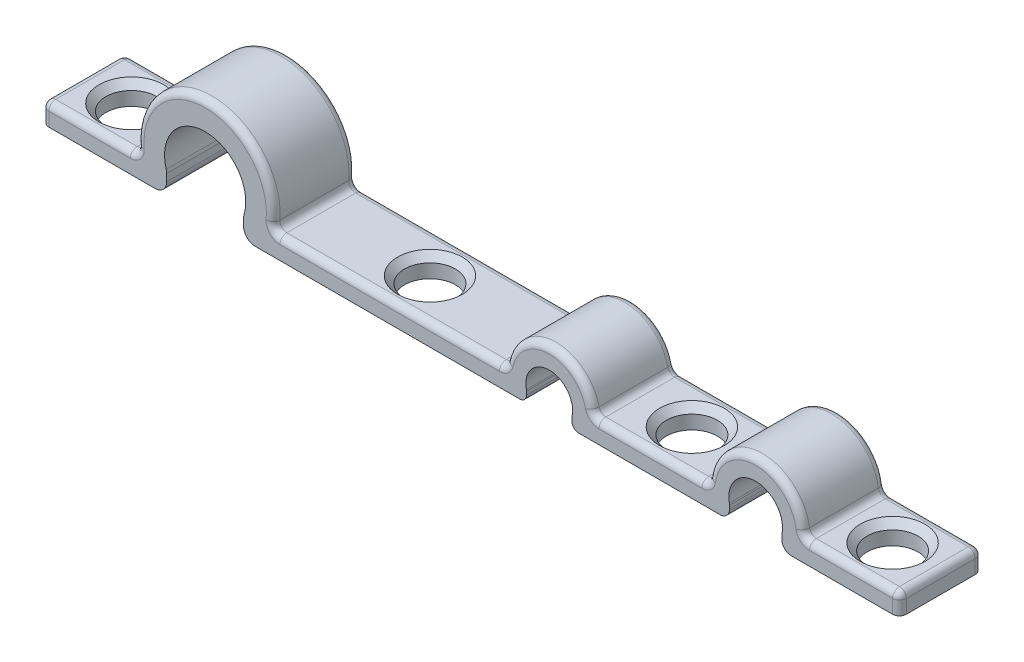
from build123d import *

# Parameters (mm, degrees)
BOSS_EXTRUDE1_DEPTH = 3
CUT_EXTRUDE2_REACH  = 34.161
SKETCH2_R           = 1.85
CHAMFER2_SIZE       = 0.5
FILLET1_R           = 0.5


with BuildPart() as part:
    # Sketch1 → Boss-Extrude1 (new, symmetric)
    with BuildSketch(Plane.XY):
        with BuildLine():
            Line((-31.153810391, 0), (-22.93867528, 0))
            ThreePointArc((-22.93867528, 0), (-22.337634516, 0.248959236), (-22.08867528, 0.85))
            Line((-22.08867528, 0.85), (-22.08867528, 1.36849254))
            ThreePointArc((-22.08867528, 1.36849254), (-22.09750929, 1.490720925), (-22.123827699, 1.610408683))
            ThreePointArc((-22.123827699, 1.610408683), (-19.295827271, 5.4), (-16.467826843, 1.610408683))
            ThreePointArc((-16.467826843, 1.610408683), (-16.494145252, 1.490720925), (-16.502979262, 1.36849254))
            Line((-16.502979262, 1.36849254), (-16.502979262, 0.85))
            ThreePointArc((-16.502979262, 0.85), (-16.254020026, 0.248959236), (-15.652979262, 0))
            Line((-15.652979262, 0), (3.554172729, 0))
            ThreePointArc((3.554172729, 0), (3.90772612, 0.146446609), (4.054172729, 0.5))
            Line((4.054172729, 0.5), (4.054172729, 0.733631047))
            ThreePointArc((4.054172729, 0.733631047), (4.051323703, 0.786931226), (4.042809093, 0.839623991))
            ThreePointArc((4.042809093, 0.839623991), (5.704172729, 2.9), (7.365536366, 0.839623991))
            ThreePointArc((7.365536366, 0.839623991), (7.357021755, 0.786931226), (7.354172729, 0.733631047))
            Line((7.354172729, 0.733631047), (7.354172729, 0.5))
            ThreePointArc((7.354172729, 0.5), (7.500619339, 0.146446609), (7.854172729, 0))
            Line((7.854172729, 0), (18.104172729, 0))
            ThreePointArc((18.104172729, 0), (18.599147476, 0.205025253), (18.804172729, 0.7))
            Line((18.804172729, 0.7), (18.804172729, 0.937652462))
            ThreePointArc((18.804172729, 0.937652462), (18.800863018, 1.005642472), (18.790965182, 1.072989547))
            ThreePointArc((18.790965182, 1.072989547), (20.704172729, 3.4), (22.617380276, 1.072989547))
            ThreePointArc((22.617380276, 1.072989547), (22.60748244, 1.005642472), (22.604172729, 0.937652462))
            Line((22.604172729, 0.937652462), (22.604172729, 0.7))
            ThreePointArc((22.604172729, 0.7), (22.809197982, 0.205025253), (23.304172729, 0))
            Line((23.304172729, 0), (31.153810391, 0))
            Line((31.153810391, 0), (31.153810391, 1.5))
            Line((31.153810391, 1.5), (24.153810391, 1.5))
            ThreePointArc((24.153810391, 1.5), (20.704172729, 4.9), (17.254535067, 1.5))
            Line((17.254535067, 1.5), (8.890079194, 1.5))
            ThreePointArc((8.890079194, 1.5), (5.704172729, 4.4), (2.518266265, 1.5))
            Line((2.518266265, 1.5), (-14.43784415, 1.5))
            ThreePointArc((-14.43784415, 1.5), (-19.295827271, 7.4), (-24.153810391, 1.5))
            Line((-24.153810391, 1.5), (-31.153810391, 1.5))
            Line((-31.153810391, 1.5), (-31.153810391, 0))
        make_face()
    extrude(amount=BOSS_EXTRUDE1_DEPTH, both=True)

    # Sketch2 → Cut-Extrude2 (cut, up to next)
    with BuildSketch(Plane(origin=(0, 0, 0), x_dir=(1, 0, 0), z_dir=(0, 1, 0)), mode=Mode.PRIVATE) as cut_extrude2_sk1:
        with Locations(Location((-27.653810391, 0, 0), (0, 0, 90))):
            Circle(SKETCH2_R)
    cut_extrude2_tool1 = extrude(cut_extrude2_sk1.sketch, amount=CUT_EXTRUDE2_REACH, mode=Mode.PRIVATE) & part.part
    # Sketch2 → Cut-Extrude2 (cut, up to next)
    with BuildSketch(Plane(origin=(0, 0, 0), x_dir=(1, 0, 0), z_dir=(0, 1, 0)), mode=Mode.PRIVATE) as cut_extrude2_sk2:
        with Locations(Location((-5.959788943, 0, 0), (0, 0, 90))):
            Circle(SKETCH2_R)
    cut_extrude2_tool2 = extrude(cut_extrude2_sk2.sketch, amount=CUT_EXTRUDE2_REACH, mode=Mode.PRIVATE) & part.part
    # Sketch2 → Cut-Extrude2 (cut, up to next)
    with BuildSketch(Plane(origin=(0, 0, 0), x_dir=(1, 0, 0), z_dir=(0, 1, 0)), mode=Mode.PRIVATE) as cut_extrude2_sk3:
        with Locations(Location((27.653810391, 0, 0), (0, 0, 90))):
            Circle(SKETCH2_R)
    cut_extrude2_tool3 = extrude(cut_extrude2_sk3.sketch, amount=CUT_EXTRUDE2_REACH, mode=Mode.PRIVATE) & part.part
    # Sketch2 → Cut-Extrude2 (cut, up to next)
    with BuildSketch(Plane(origin=(0, 0, 0), x_dir=(1, 0, 0), z_dir=(0, 1, 0)), mode=Mode.PRIVATE) as cut_extrude2_sk4:
        with Locations(Location((13.07230713, 0, 0), (0, 0, 90))):
            Circle(SKETCH2_R)
    cut_extrude2_tool4 = extrude(cut_extrude2_sk4.sketch, amount=CUT_EXTRUDE2_REACH, mode=Mode.PRIVATE) & part.part
    add(cut_extrude2_tool1.solids().sort_by_distance((-27.65381, 0, 0))[0], mode=Mode.SUBTRACT)
    add(cut_extrude2_tool2.solids().sort_by_distance((-5.959789, 0, 0))[0], mode=Mode.SUBTRACT)
    add(cut_extrude2_tool3.solids().sort_by_distance((27.65381, 0, 0))[0], mode=Mode.SUBTRACT)
    add(cut_extrude2_tool4.solids().sort_by_distance((13.072307, 0, 0))[0], mode=Mode.SUBTRACT)

    # Chamfer2
    chamfer2_edges = [part.edges().sort_by_distance(p)[0] for p in [
        (-27.653810391, 1.5, 1.85),
        (-5.959788943, 1.5, 1.85),
        (13.07230713, 1.5, 1.85),
        (27.653810391, 1.5, 1.85),
    ]]
    chamfer(chamfer2_edges, length=CHAMFER2_SIZE)

    # Fillet1
    fillet1_edges = [part.edges().sort_by_distance(p)[0] for p in [
        (5.704172729, 4.4, 3),
        (31.153810391, 0.75, 3),
        (27.653810391, 1.5, 3),
        (-5.959788943, 1.5, 3),
        (-19.295827271, 7.4, 3),
        (-27.653810391, 1.5, 3),
        (-31.153810391, 0.75, 3),
        (27.653810391, 1.5, -3),
        (31.153810391, 0.75, -3),
        (-31.153810391, 0.75, -3),
        (-27.653810391, 1.5, -3),
        (-19.295827271, 7.4, -3),
        (-5.959788943, 1.5, -3),
        (5.704172729, 4.4, -3),
        (13.07230713, 1.5, -3),
        (20.704172729, 4.9, -3),
        (20.704172729, 4.9, 3),
        (24.153810391, 1.5, 0),
        (31.153810391, 1.5, 0),
        (-31.153810391, 1.5, 0),
        (-24.153810391, 1.5, 0),
        (-14.43784415, 1.5, 0),
        (2.518266265, 1.5, 0),
        (8.890079194, 1.5, 0),
        (17.254535067, 1.5, 0),
        (13.07230713, 1.5, 3),
    ]]
    fillet(fillet1_edges, radius=FILLET1_R)


solid = part.part
